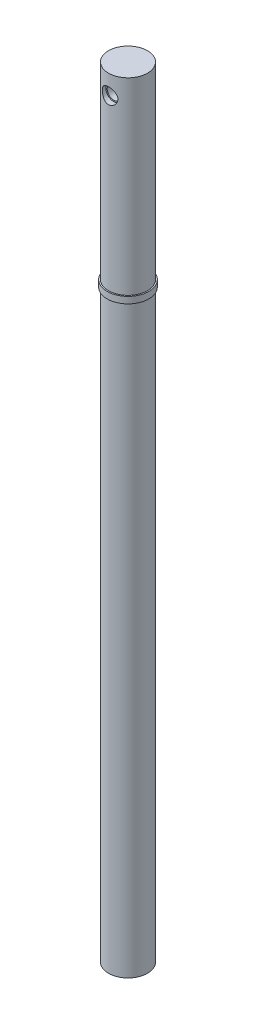
from build123d import *

# Parameters (mm, degrees)
SKETCH2_R           = 1.5
SKETCH4_R           = 0.5
CUT_EXTRUDE1_DEPTH  = 2
CUT_EXTRUDE2_START  = 1.6
SKETCH6_R           = 0.6
CUT_EXTRUDE2_DEPTH  = 0.5
BOSS_EXTRUDE1_START = -15
SKETCH7_R           = 1.6
BOSS_EXTRUDE1_DEPTH = 0.5


with BuildPart() as part:
    # Sweep1: sweep along a path in Sketch3
    with BuildLine(Plane(origin=(0, 0, 0), x_dir=(0, 0, -1), z_dir=(1, 0, 0))) as sweep1_path:
        Line((0, 0), (0, -60))
    # Sketch2 → Sweep1 (sweep)
    with BuildSketch(Plane(origin=(0, 0, 0), x_dir=(1, 0, 0), z_dir=(0, 1, 0))):
        Circle(SKETCH2_R)
    sweep(path=sweep1_path.line)

    # Sketch4 → Cut-Extrude1 (cut, symmetric)
    with BuildSketch(Plane.XY):
        with Locations(Location((0, -1.5, 0), (0, 0, 89.999999987))):
            Circle(SKETCH4_R)
    extrude(amount=CUT_EXTRUDE1_DEPTH, both=True, mode=Mode.SUBTRACT)

    # Sketch6 → Cut-Extrude2 (cut)
    with BuildSketch(Plane.XY.offset(CUT_EXTRUDE2_START)):
        with Locations((0, -1.5)):
            Circle(SKETCH6_R)
    extrude(amount=-CUT_EXTRUDE2_DEPTH, mode=Mode.SUBTRACT)

    # Sketch7 → Boss-Extrude1 (add)
    with BuildSketch(Plane(origin=(0, 0, 0), x_dir=(1, 0, 0), z_dir=(0, 1, 0)).offset(BOSS_EXTRUDE1_START)):
        with Locations(Location((0, 0, 0), (0, 0, 270))):
            Circle(SKETCH7_R)
    extrude(amount=BOSS_EXTRUDE1_DEPTH)


solid = part.part
